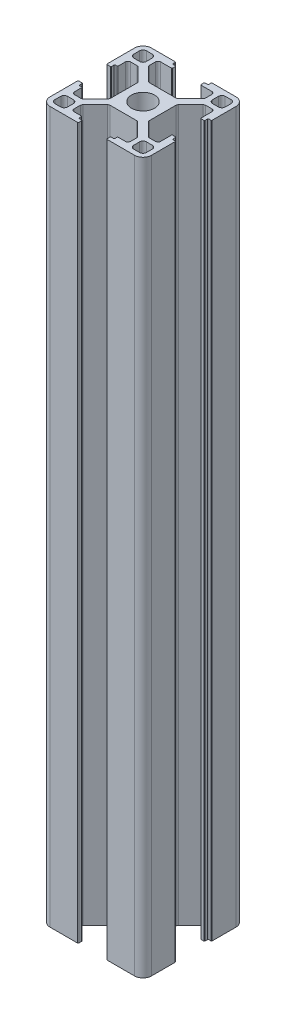
from build123d import *

# Parameters (mm, degrees)
BOSS_EXTRUDE3_START = 1
BOSS_EXTRUDE3_DEPTH = 210.44


with BuildPart() as part:
    # Sketch2 → Boss-Extrude3 (new body)
    with BuildSketch(Plane(origin=(0, -1630.441117946, 0), x_dir=(1, 0, 0), z_dir=(0, 1, 0)).offset(BOSS_EXTRUDE3_START)):
        with BuildLine():
            Line((-1199.016809522, 0), (-1206.016809522, 0))
            ThreePointArc((-1206.016809522, 0), (-1207.784576475, -0.732233047), (-1208.516809522, -2.5))
            Line((-1208.516809522, -2.5), (-1208.516809522, -10.6))
            ThreePointArc((-1208.516809522, -10.6), (-1208.458230878, -10.741421356), (-1208.316809522, -10.8))
            Line((-1208.316809522, -10.8), (-1207.384378664, -10.8))
            ThreePointArc((-1207.384378664, -10.8), (-1207.242957308, -10.741421356), (-1207.184378664, -10.6))
            Line((-1207.184378664, -10.6), (-1207.184378664, -9.9))
            ThreePointArc((-1207.184378664, -9.9), (-1207.12580002, -9.758578644), (-1206.984378664, -9.7))
            Line((-1206.984378664, -9.7), (-1206.516809522, -9.7))
            ThreePointArc((-1206.516809522, -9.7), (-1206.375388166, -9.641421356), (-1206.316809522, -9.5))
            Line((-1206.316809522, -9.5), (-1206.316809522, -7.4))
            ThreePointArc((-1206.316809522, -7.4), (-1206.097139608, -6.869669914), (-1205.566809522, -6.65))
            Line((-1205.566809522, -6.65), (-1203.600673754, -6.65))
            ThreePointArc((-1203.600673754, -6.65), (-1203.31366118, -6.707090351), (-1203.070343668, -6.869669914))
            Line((-1203.070343668, -6.869669914), (-1199.404048578, -10.535965005))
            ThreePointArc((-1199.404048578, -10.535965005), (-1199.241469014, -10.779282516), (-1199.184378664, -11.06629509))
            Line((-1199.184378664, -11.06629509), (-1199.184378664, -18.93370491))
            ThreePointArc((-1199.184378664, -18.93370491), (-1199.241469014, -19.220717484), (-1199.404048578, -19.464034995))
            Line((-1199.404048578, -19.464034995), (-1203.070343668, -23.130330086))
            ThreePointArc((-1203.070343668, -23.130330086), (-1203.31366118, -23.292909649), (-1203.600673754, -23.35))
            Line((-1203.600673754, -23.35), (-1205.434378664, -23.35))
            ThreePointArc((-1205.434378664, -23.35), (-1205.96470875, -23.130330086), (-1206.184378664, -22.6))
            Line((-1206.184378664, -22.6), (-1206.184378664, -20.5))
            ThreePointArc((-1206.184378664, -20.5), (-1206.242957308, -20.358578644), (-1206.384378664, -20.3))
            Line((-1206.384378664, -20.3), (-1206.984378664, -20.3))
            ThreePointArc((-1206.984378664, -20.3), (-1207.12580002, -20.241421356), (-1207.184378664, -20.1))
            Line((-1207.184378664, -20.1), (-1207.184378664, -19.4))
            ThreePointArc((-1207.184378664, -19.4), (-1207.242957308, -19.258578644), (-1207.384378664, -19.2))
            Line((-1207.384378664, -19.2), (-1208.316809522, -19.2))
            ThreePointArc((-1208.316809522, -19.2), (-1208.458230878, -19.258578644), (-1208.516809522, -19.4))
            Line((-1208.516809522, -19.4), (-1208.516809522, -27.5))
            ThreePointArc((-1208.516809522, -27.5), (-1207.784576475, -29.267766953), (-1206.016809522, -30))
            Line((-1206.016809522, -30), (-1197.916809522, -30))
            ThreePointArc((-1197.916809522, -30), (-1197.775388166, -29.941421356), (-1197.716809522, -29.8))
            Line((-1197.716809522, -29.8), (-1197.716809522, -29))
            ThreePointArc((-1197.716809522, -29), (-1197.775388166, -28.858578644), (-1197.916809522, -28.8))
            Line((-1197.916809522, -28.8), (-1198.616809522, -28.8))
            ThreePointArc((-1198.616809522, -28.8), (-1198.758230878, -28.741421356), (-1198.816809522, -28.6))
            Line((-1198.816809522, -28.6), (-1198.816809522, -28))
            ThreePointArc((-1198.816809522, -28), (-1198.875388166, -27.858578644), (-1199.016809522, -27.8))
            Line((-1199.016809522, -27.8), (-1201.116809522, -27.8))
            ThreePointArc((-1201.116809522, -27.8), (-1201.647139608, -27.580330086), (-1201.866809522, -27.05))
            Line((-1201.866809522, -27.05), (-1201.866809522, -25.21629509))
            ThreePointArc((-1201.866809522, -25.21629509), (-1201.809719171, -24.929282516), (-1201.647139608, -24.685965005))
            Line((-1201.647139608, -24.685965005), (-1197.980844518, -21.019669914))
            ThreePointArc((-1197.980844518, -21.019669914), (-1197.737527006, -20.857090351), (-1197.450514432, -20.8))
            Line((-1197.450514432, -20.8), (-1189.583104612, -20.8))
            ThreePointArc((-1189.583104612, -20.8), (-1189.296092038, -20.857090351), (-1189.052774527, -21.019669914))
            Line((-1189.052774527, -21.019669914), (-1185.386479436, -24.685965005))
            ThreePointArc((-1185.386479436, -24.685965005), (-1185.223899873, -24.929282516), (-1185.166809522, -25.21629509))
            Line((-1185.166809522, -25.21629509), (-1185.166809522, -27.05))
            ThreePointArc((-1185.166809522, -27.05), (-1185.386479436, -27.580330086), (-1185.916809522, -27.8))
            Line((-1185.916809522, -27.8), (-1188.016809522, -27.8))
            ThreePointArc((-1188.016809522, -27.8), (-1188.158230878, -27.858578644), (-1188.216809522, -28))
            Line((-1188.216809522, -28), (-1188.216809522, -28.6))
            ThreePointArc((-1188.216809522, -28.6), (-1188.275388166, -28.741421356), (-1188.416809522, -28.8))
            Line((-1188.416809522, -28.8), (-1189.116809522, -28.8))
            ThreePointArc((-1189.116809522, -28.8), (-1189.258230878, -28.858578644), (-1189.316809522, -29))
            Line((-1189.316809522, -29), (-1189.316809522, -29.8))
            ThreePointArc((-1189.316809522, -29.8), (-1189.258230878, -29.941421356), (-1189.116809522, -30))
            Line((-1189.116809522, -30), (-1181.016809522, -30))
            ThreePointArc((-1181.016809522, -30), (-1179.249042569, -29.267766953), (-1178.516809522, -27.5))
            Line((-1178.516809522, -27.5), (-1178.516809522, -20.5))
            ThreePointArc((-1178.516809522, -20.5), (-1178.575388166, -20.358578644), (-1178.716809522, -20.3))
            Line((-1178.716809522, -20.3), (-1179.316809522, -20.3))
            ThreePointArc((-1179.316809522, -20.3), (-1179.458230878, -20.241421356), (-1179.516809522, -20.1))
            Line((-1179.516809522, -20.1), (-1179.516809522, -19.4))
            ThreePointArc((-1179.516809522, -19.4), (-1179.575388166, -19.258578644), (-1179.716809522, -19.2))
            Line((-1179.716809522, -19.2), (-1180.516809522, -19.2))
            ThreePointArc((-1180.516809522, -19.2), (-1180.658230878, -19.258578644), (-1180.716809522, -19.4))
            Line((-1180.716809522, -19.4), (-1180.716809522, -22.6))
            ThreePointArc((-1180.716809522, -22.6), (-1180.936479436, -23.130330086), (-1181.466809522, -23.35))
            Line((-1181.466809522, -23.35), (-1183.300514432, -23.35))
            ThreePointArc((-1183.300514432, -23.35), (-1183.587527006, -23.292909649), (-1183.830844518, -23.130330086))
            Line((-1183.830844518, -23.130330086), (-1187.497139608, -19.464034995))
            ThreePointArc((-1187.497139608, -19.464034995), (-1187.659719171, -19.220717484), (-1187.716809522, -18.93370491))
            Line((-1187.716809522, -18.93370491), (-1187.716809522, -11.06629509))
            ThreePointArc((-1187.716809522, -11.06629509), (-1187.659719171, -10.779282516), (-1187.497139608, -10.535965005))
            Line((-1187.497139608, -10.535965005), (-1183.830844518, -6.869669914))
            ThreePointArc((-1183.830844518, -6.869669914), (-1183.587527006, -6.707090351), (-1183.300514432, -6.65))
            Line((-1183.300514432, -6.65), (-1181.466809522, -6.65))
            ThreePointArc((-1181.466809522, -6.65), (-1180.936479436, -6.869669914), (-1180.716809522, -7.4))
            Line((-1180.716809522, -7.4), (-1180.716809522, -10.6))
            ThreePointArc((-1180.716809522, -10.6), (-1180.658230878, -10.741421356), (-1180.516809522, -10.8))
            Line((-1180.516809522, -10.8), (-1179.716809522, -10.8))
            ThreePointArc((-1179.716809522, -10.8), (-1179.575388166, -10.741421356), (-1179.516809522, -10.6))
            Line((-1179.516809522, -10.6), (-1179.516809522, -9.9))
            ThreePointArc((-1179.516809522, -9.9), (-1179.458230878, -9.758578644), (-1179.316809522, -9.7))
            Line((-1179.316809522, -9.7), (-1178.716809522, -9.7))
            ThreePointArc((-1178.716809522, -9.7), (-1178.575388166, -9.641421356), (-1178.516809522, -9.5))
            Line((-1178.516809522, -9.5), (-1178.516809522, -2.5))
            ThreePointArc((-1178.516809522, -2.5), (-1179.249042569, -0.732233047), (-1181.016809522, 0))
            Line((-1181.016809522, 0), (-1188.016809522, 0))
            ThreePointArc((-1188.016809522, 0), (-1188.158230878, -0.058578644), (-1188.216809522, -0.2))
            Line((-1188.216809522, -0.2), (-1188.216809522, -0.8))
            ThreePointArc((-1188.216809522, -0.8), (-1188.275388166, -0.941421356), (-1188.416809522, -1))
            Line((-1188.416809522, -1), (-1189.116809522, -1))
            ThreePointArc((-1189.116809522, -1), (-1189.258230878, -1.058578644), (-1189.316809522, -1.2))
            Line((-1189.316809522, -1.2), (-1189.316809522, -2))
            ThreePointArc((-1189.316809522, -2), (-1189.258230878, -2.141421356), (-1189.116809522, -2.2))
            Line((-1189.116809522, -2.2), (-1185.916809522, -2.2))
            ThreePointArc((-1185.916809522, -2.2), (-1185.386479436, -2.419669914), (-1185.166809522, -2.95))
            Line((-1185.166809522, -2.95), (-1185.166809522, -4.78370491))
            ThreePointArc((-1185.166809522, -4.78370491), (-1185.223899873, -5.070717484), (-1185.386479436, -5.314034995))
            Line((-1185.386479436, -5.314034995), (-1189.052774527, -8.980330086))
            ThreePointArc((-1189.052774527, -8.980330086), (-1189.296092038, -9.142909649), (-1189.583104612, -9.2))
            Line((-1189.583104612, -9.2), (-1197.450514432, -9.2))
            ThreePointArc((-1197.450514432, -9.2), (-1197.737527006, -9.142909649), (-1197.980844518, -8.980330086))
            Line((-1197.980844518, -8.980330086), (-1201.647139608, -5.314034995))
            ThreePointArc((-1201.647139608, -5.314034995), (-1201.809719171, -5.070717484), (-1201.866809522, -4.78370491))
            Line((-1201.866809522, -4.78370491), (-1201.866809522, -2.95))
            ThreePointArc((-1201.866809522, -2.95), (-1201.647139608, -2.419669914), (-1201.116809522, -2.2))
            Line((-1201.116809522, -2.2), (-1197.916809522, -2.2))
            ThreePointArc((-1197.916809522, -2.2), (-1197.775388166, -2.141421356), (-1197.716809522, -2))
            Line((-1197.716809522, -2), (-1197.716809522, -1.2))
            ThreePointArc((-1197.716809522, -1.2), (-1197.775388166, -1.058578644), (-1197.916809522, -1))
            Line((-1197.916809522, -1), (-1198.616809522, -1))
            ThreePointArc((-1198.616809522, -1), (-1198.758230878, -0.941421356), (-1198.816809522, -0.8))
            Line((-1198.816809522, -0.8), (-1198.816809522, -0.2))
            ThreePointArc((-1198.816809522, -0.2), (-1198.875388166, -0.058578644), (-1199.016809522, 0))
        make_face()
        with BuildLine():
            Line((-1206.066809522, -28.55), (-1204.316809522, -28.55))
            ThreePointArc((-1204.316809522, -28.55), (-1203.609702741, -28.257106781), (-1203.316809522, -27.55))
            Line((-1203.316809522, -27.55), (-1203.316809522, -25.8))
            ThreePointArc((-1203.316809522, -25.8), (-1203.609702741, -25.092893219), (-1204.316809522, -24.8))
            Line((-1204.316809522, -24.8), (-1206.066809522, -24.8))
            ThreePointArc((-1206.066809522, -24.8), (-1206.773916303, -25.092893219), (-1207.066809522, -25.8))
            Line((-1207.066809522, -25.8), (-1207.066809522, -27.55))
            ThreePointArc((-1207.066809522, -27.55), (-1206.773916303, -28.257106781), (-1206.066809522, -28.55))
        make_face(mode=Mode.SUBTRACT)
        with BuildLine():
            Line((-1206.066809522, -5.2), (-1204.316809522, -5.2))
            ThreePointArc((-1204.316809522, -5.2), (-1203.609702741, -4.907106781), (-1203.316809522, -4.2))
            Line((-1203.316809522, -4.2), (-1203.316809522, -2.45))
            ThreePointArc((-1203.316809522, -2.45), (-1203.609702741, -1.742893219), (-1204.316809522, -1.45))
            Line((-1204.316809522, -1.45), (-1206.066809522, -1.45))
            ThreePointArc((-1206.066809522, -1.45), (-1206.773916303, -1.742893219), (-1207.066809522, -2.45))
            Line((-1207.066809522, -2.45), (-1207.066809522, -4.2))
            ThreePointArc((-1207.066809522, -4.2), (-1206.773916303, -4.907106781), (-1206.066809522, -5.2))
        make_face(mode=Mode.SUBTRACT)
        with BuildLine():
            Line((-1180.966809522, -24.8), (-1182.716809522, -24.8))
            ThreePointArc((-1182.716809522, -24.8), (-1183.423916303, -25.092893219), (-1183.716809522, -25.8))
            Line((-1183.716809522, -25.8), (-1183.716809522, -27.55))
            ThreePointArc((-1183.716809522, -27.55), (-1183.423916303, -28.257106781), (-1182.716809522, -28.55))
            Line((-1182.716809522, -28.55), (-1180.966809522, -28.55))
            ThreePointArc((-1180.966809522, -28.55), (-1180.259702741, -28.257106781), (-1179.966809522, -27.55))
            Line((-1179.966809522, -27.55), (-1179.966809522, -25.8))
            ThreePointArc((-1179.966809522, -25.8), (-1180.259702741, -25.092893219), (-1180.966809522, -24.8))
        make_face(mode=Mode.SUBTRACT)
        with BuildLine():
            Line((-1182.716809522, -5.2), (-1180.966809522, -5.2))
            ThreePointArc((-1180.966809522, -5.2), (-1180.259702741, -4.907106781), (-1179.966809522, -4.2))
            Line((-1179.966809522, -4.2), (-1179.966809522, -2.45))
            ThreePointArc((-1179.966809522, -2.45), (-1180.259702741, -1.742893219), (-1180.966809522, -1.45))
            Line((-1180.966809522, -1.45), (-1182.716809522, -1.45))
            ThreePointArc((-1182.716809522, -1.45), (-1183.423916303, -1.742893219), (-1183.716809522, -2.45))
            Line((-1183.716809522, -2.45), (-1183.716809522, -4.2))
            ThreePointArc((-1183.716809522, -4.2), (-1183.423916303, -4.907106781), (-1182.716809522, -5.2))
        make_face(mode=Mode.SUBTRACT)
        with BuildLine():
            ThreePointArc((-1193.516809522, -11.6), (-1196.916809522, -15), (-1193.516809522, -18.4))
            ThreePointArc((-1193.516809522, -18.4), (-1190.116809522, -15), (-1193.516809522, -11.6))
        make_face(mode=Mode.SUBTRACT)
    extrude(amount=BOSS_EXTRUDE3_DEPTH)


solid = part.part
